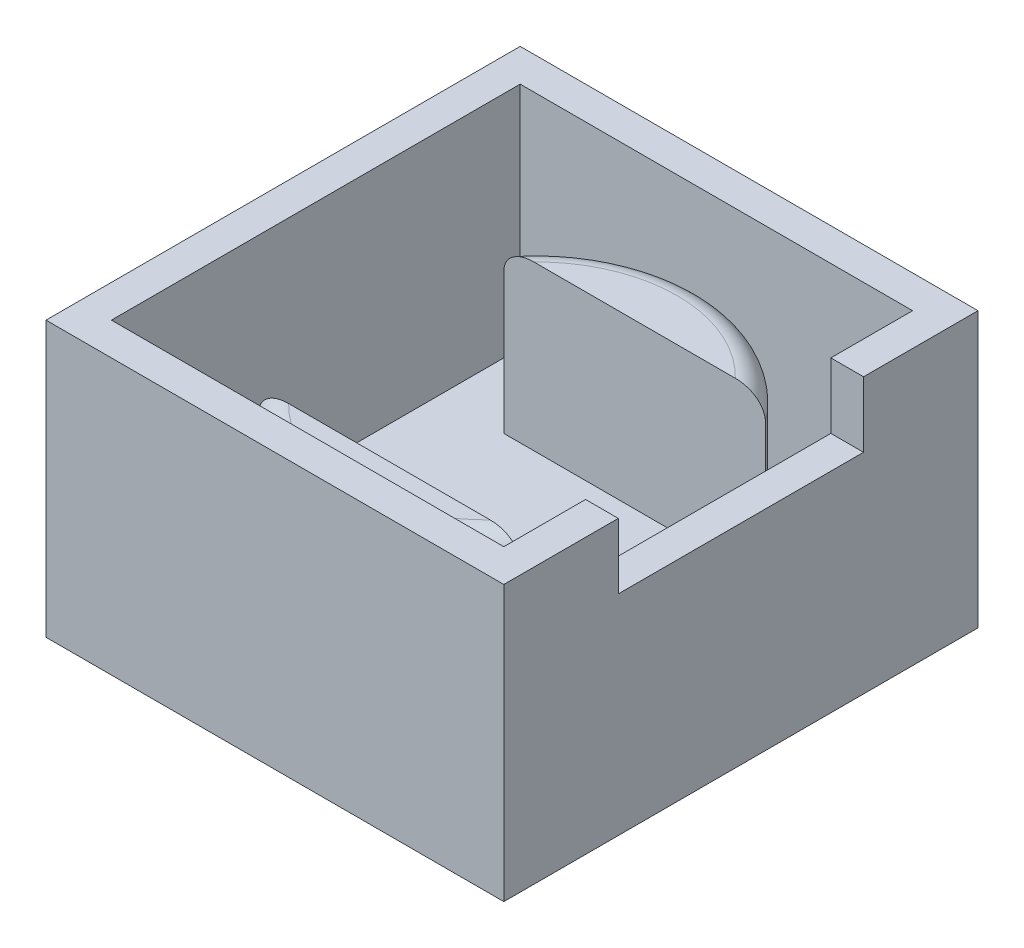
from build123d import *

# Parameters (mm, degrees)
SKETCH1_W            = 30.48
SKETCH1_H            = 31.75
BOSS_EXTRUDE1_DEPTH  = 3.556
BOSS_EXTRUDE2_DEPTH  = 12.7
SKETCH4_W            = 69.596
SKETCH4_H            = 73.406
BOSS_EXTRUDE3_DEPTH  = 3.556
BOSS_EXTRUDE5_DEPTH  = 12.7
MIRROR2_COPY_1_DEPTH = 12.7
MIRROR4_COPY_1_DEPTH = 12.7
FILLET5_R            = 1.778
BOSS_EXTRUDE7_REACH  = 82.336
SKETCH9_W            = 1.524
SKETCH9_H            = 35.306
SKETCH9_H_2          = 2.794
SKETCH9_W_2          = 34.036
CUT_EXTRUDE1_DEPTH   = 81.335506123
SKETCH11_W           = 35.56
SKETCH11_H           = 36.83
SKETCH11_W_2         = 34.036
SKETCH11_H_2         = 35.306
BOSS_EXTRUDE8_DEPTH  = 16.256
BOSS_EXTRUDE9_DEPTH  = 5.08


with BuildPart() as part:
    # Sketch1 → Boss-Extrude1 (new body)
    with BuildSketch(Plane(origin=(0, 0, 0), x_dir=(1, 0, 0), z_dir=(0, 1, 0))):
        with Locations((15.24, 15.875)):
            Rectangle(SKETCH1_W, SKETCH1_H)
    extrude(amount=BOSS_EXTRUDE1_DEPTH)

    # Sketch2 → Boss-Extrude2 (add)
    with BuildSketch(Plane(origin=(0, 3.556, 0), x_dir=(1, 0, 0), z_dir=(0, 1, 0))):
        with BuildLine():
            Line((25.4, 6.35), (5.08, 6.35))
            ThreePointArc((5.08, 6.35), (15.24, 1.27), (25.4, 6.35))
        make_face()
        with BuildLine():
            ThreePointArc((25.4, 25.4), (15.24, 30.48), (5.08, 25.4))
            Line((5.08, 25.4), (25.4, 25.4))
        make_face()
    boss_extrude2 = extrude(amount=BOSS_EXTRUDE2_DEPTH)

    # Sketch4 → Boss-Extrude3 (add)
    with BuildSketch(Plane(origin=(0, 3.556, 0), x_dir=(1, 0, 0), z_dir=(0, 1, 0))):
        with Locations((33.02, -3.175)):
            Rectangle(SKETCH4_W, SKETCH4_H)
    extrude(amount=-BOSS_EXTRUDE3_DEPTH)

    # Sketch8 → Boss-Extrude5 (add)
    with BuildSketch(Plane(origin=(0, 3.556, 0), x_dir=(1, 0, 0), z_dir=(0, 1, 0))):
        Polygon((-1.778, 33.528), (-1.778, 27.178), (-1.778, 4.572), (-1.778, -1.778), (32.258, -1.778), (32.258, 33.528), align=None)
        Polygon((0, 27.178), (0, 31.75), (30.48, 31.75), (30.48, 0), (0, 0), (0, 4.572), align=None, mode=Mode.SUBTRACT)
    boss_extrude5 = extrude(amount=BOSS_EXTRUDE5_DEPTH)

    # Mirror1: Boss-Extrude5 across plane
    add(boss_extrude5.mirror(Plane(origin=(0, 0, 3.175), x_dir=(1, 0, 0), z_dir=(0, 0, -1))))

    # Mirror2: Boss-Extrude5 across plane
    add(boss_extrude5.mirror(Plane(origin=(33.02, 0, 0), x_dir=(0, 0, 1), z_dir=(1, 0, 0))))

    # Mirror2 copy 1 sketch → Mirror2 copy 1 (add)
    with BuildSketch(Plane(origin=(66.04, 3.556, 6.35), x_dir=(-1, 0, 0), z_dir=(0, 1, 0))):
        Polygon((-1.778, 33.528), (-1.778, 27.178), (-1.778, 4.572), (-1.778, -1.778), (32.258, -1.778), (32.258, 33.528), align=None)
        Polygon((0, 27.178), (0, 31.75), (30.48, 31.75), (30.48, 0), (0, 0), (0, 4.572), align=None, mode=Mode.SUBTRACT)
    extrude(amount=MIRROR2_COPY_1_DEPTH)

    # Mirror3: Boss-Extrude2 across plane
    add(boss_extrude2.mirror(Plane(origin=(0, 0, 3.175), x_dir=(1, 0, 0), z_dir=(0, 0, -1))))

    # Mirror4: Boss-Extrude2 across plane
    add(boss_extrude2.mirror(Plane(origin=(33.02, 0, 0), x_dir=(0, 0, 1), z_dir=(1, 0, 0))))

    # Mirror4 copy 1 sketch → Mirror4 copy 1 (add)
    with BuildSketch(Plane(origin=(66.04, 3.556, 6.35), x_dir=(-1, 0, 0), z_dir=(0, 1, 0))):
        with BuildLine():
            Line((25.4, 6.35), (5.08, 6.35))
            ThreePointArc((5.08, 6.35), (15.24, 1.27), (25.4, 6.35))
        make_face()
        with BuildLine():
            ThreePointArc((25.4, 25.4), (15.24, 30.48), (5.08, 25.4))
            Line((5.08, 25.4), (25.4, 25.4))
        make_face()
    extrude(amount=MIRROR4_COPY_1_DEPTH)

    # Fillet5
    fillet5_edges = [part.edges().sort_by_distance(p)[0] for p in [
        (15.24, 16.256, -1.27),
        (15.24, 16.256, 7.62),
        (15.24, 16.256, 36.83),
        (50.8, 16.256, 7.62),
        (50.8, 16.256, 36.83),
        (50.8, 16.256, -1.27),
        (50.8, 16.256, -30.48),
        (15.24, 16.256, -30.48),
    ]]
    fillet(fillet5_edges, radius=FILLET5_R)

    # Sketch9 → Boss-Extrude7 (add, up to next)
    with BuildSketch(Plane(origin=(0, 16.256, 0), x_dir=(1, 0, 0), z_dir=(0, 1, 0)), mode=Mode.PRIVATE) as boss_extrude7_sk1:
        with Locations((33.02, 15.875)):
            Rectangle(SKETCH9_W, SKETCH9_H)
    boss_extrude7_tool1 = extrude(boss_extrude7_sk1.sketch, amount=-BOSS_EXTRUDE7_REACH, mode=Mode.PRIVATE) - part.part
    # Sketch9 → Boss-Extrude7 (add, up to next)
    with BuildSketch(Plane(origin=(0, 16.256, 0), x_dir=(1, 0, 0), z_dir=(0, 1, 0)), mode=Mode.PRIVATE) as boss_extrude7_sk2:
        with Locations((33.02, -22.225)):
            Rectangle(SKETCH9_W, SKETCH9_H)
    boss_extrude7_tool2 = extrude(boss_extrude7_sk2.sketch, amount=-BOSS_EXTRUDE7_REACH, mode=Mode.PRIVATE) - part.part
    # Sketch9 → Boss-Extrude7 (add, up to next)
    with BuildSketch(Plane(origin=(0, 16.256, 0), x_dir=(1, 0, 0), z_dir=(0, 1, 0)), mode=Mode.PRIVATE) as boss_extrude7_sk3:
        with Locations((33.02, -3.175)):
            Rectangle(SKETCH9_W, SKETCH9_H_2)
    boss_extrude7_tool3 = extrude(boss_extrude7_sk3.sketch, amount=-BOSS_EXTRUDE7_REACH, mode=Mode.PRIVATE) - part.part
    # Sketch9 → Boss-Extrude7 (add, up to next)
    with BuildSketch(Plane(origin=(0, 16.256, 0), x_dir=(1, 0, 0), z_dir=(0, 1, 0)), mode=Mode.PRIVATE) as boss_extrude7_sk4:
        with Locations((50.8, -3.175)):
            Rectangle(SKETCH9_W_2, SKETCH9_H_2)
    boss_extrude7_tool4 = extrude(boss_extrude7_sk4.sketch, amount=-BOSS_EXTRUDE7_REACH, mode=Mode.PRIVATE) - part.part
    # Sketch9 → Boss-Extrude7 (add, up to next)
    with BuildSketch(Plane(origin=(0, 16.256, 0), x_dir=(1, 0, 0), z_dir=(0, 1, 0)), mode=Mode.PRIVATE) as boss_extrude7_sk5:
        with Locations((15.24, -3.175)):
            Rectangle(SKETCH9_W_2, SKETCH9_H_2)
    boss_extrude7_tool5 = extrude(boss_extrude7_sk5.sketch, amount=-BOSS_EXTRUDE7_REACH, mode=Mode.PRIVATE) - part.part
    add(boss_extrude7_tool1.solids().sort_by_distance((33.02, 16.256, -15.875))[0])
    add(boss_extrude7_tool2.solids().sort_by_distance((33.02, 16.256, 22.225))[0])
    add(boss_extrude7_tool3.solids().sort_by_distance((33.02, 16.256, 3.175))[0])
    add(boss_extrude7_tool4.solids().sort_by_distance((50.8, 16.256, 3.175))[0])
    add(boss_extrude7_tool5.solids().sort_by_distance((15.24, 16.256, 3.175))[0])

    # Sketch10 → Cut-Extrude1 (cut, through all)
    with BuildSketch(Plane(origin=(0, 16.256, 0), x_dir=(1, 0, 0), z_dir=(0, 1, 0))):
        Polygon((67.818, -4.572), (33.782, -4.572), (33.782, -39.878), (-10.061280672, -39.878), (-10.061280672, 34.690827012), (71.018790947, 34.690827012), (71.018790947, -4.572), align=None)
    extrude(amount=-CUT_EXTRUDE1_DEPTH, mode=Mode.SUBTRACT)

    # Sketch11 → Boss-Extrude8 (add)
    with BuildSketch(Plane(origin=(0, 16.256, 0), x_dir=(1, 0, 0), z_dir=(0, 1, 0))):
        with Locations((50.8, -22.225)):
            Rectangle(SKETCH11_W, SKETCH11_H)
        with Locations((50.8, -22.225)):
            Rectangle(SKETCH11_W_2, SKETCH11_H_2, mode=Mode.SUBTRACT)
    extrude(amount=-BOSS_EXTRUDE8_DEPTH)

    # Sketch12 → Boss-Extrude9 (add)
    with BuildSketch(Plane(origin=(0, 16.256, 0), x_dir=(1, 0, 0), z_dir=(0, 1, 0))):
        Polygon((66.04, -12.7), (68.58, -12.7), (68.58, -3.81), (33.02, -3.81), (33.02, -40.64), (68.58, -40.64), (68.58, -31.75), (66.04, -31.75), (66.04, -38.1), (35.56, -38.1), (35.56, -6.35), (66.04, -6.35), align=None)
    extrude(amount=BOSS_EXTRUDE9_DEPTH)


solid = part.part
